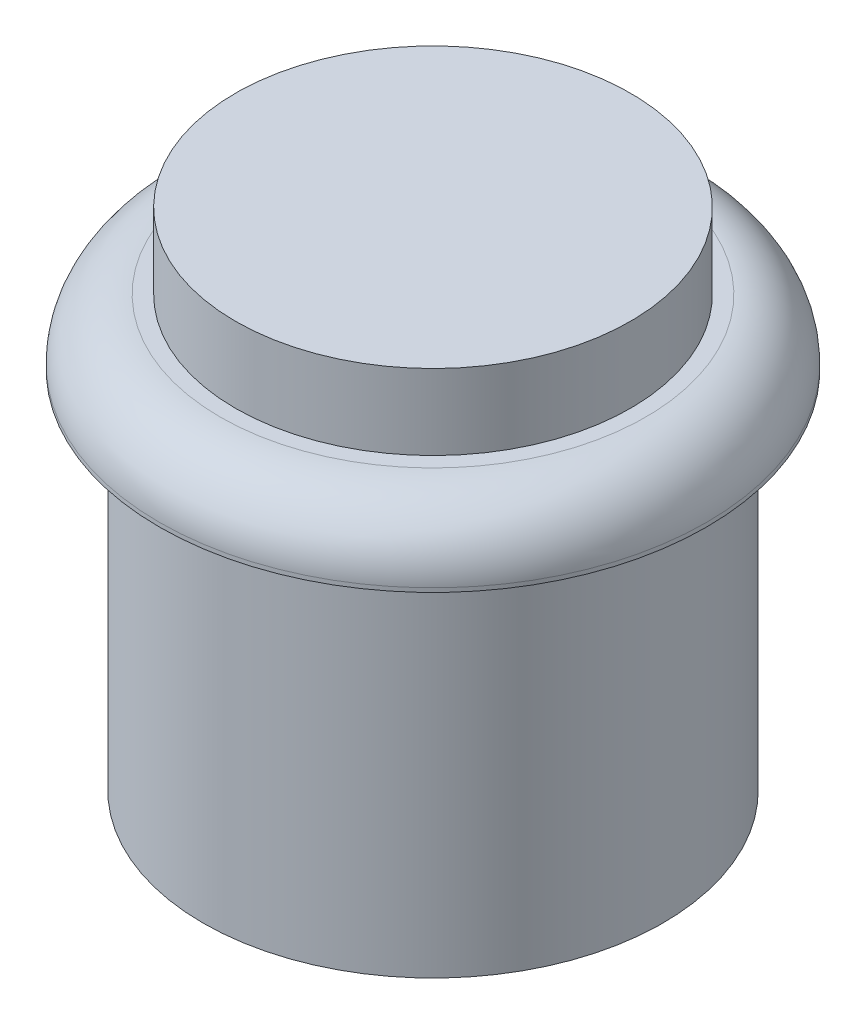
from build123d import *

# Parameters (mm, degrees)
SKETCH1_R           = 11.35
BOSS_EXTRUDE1_DEPTH = 18
SKETCH2_R           = 13.5
BOSS_EXTRUDE2_DEPTH = 3.2
FILLET1_R           = 3
SKETCH3_R           = 9.75
BOSS_EXTRUDE3_DEPTH = 3.72


with BuildPart() as part:
    # Sketch1 → Boss-Extrude1 (new body)
    with BuildSketch(Plane(origin=(0, 0, 0), x_dir=(1, 0, 0), z_dir=(0, 1, 0))):
        with Locations(Location((0, 0, 0), (0, 0, 270))):
            Circle(SKETCH1_R)
    extrude(amount=-BOSS_EXTRUDE1_DEPTH)

    # Sketch2 → Boss-Extrude2 (add)
    with BuildSketch(Plane(origin=(0, 0, 0), x_dir=(1, 0, 0), z_dir=(0, 1, 0))):
        with Locations(Location((0, 0, 0), (0, 0, 270))):
            Circle(SKETCH2_R)
    extrude(amount=BOSS_EXTRUDE2_DEPTH)

    # Fillet1
    fillet1_edges = [part.edges().sort_by_distance(p)[0] for p in [
        (0, 3.2, -13.5),
    ]]
    fillet(fillet1_edges, radius=FILLET1_R)

    # Sketch3 → Boss-Extrude3 (add)
    with BuildSketch(Plane(origin=(0, 3.2, 0), x_dir=(1, 0, 0), z_dir=(0, 1, 0))):
        with Locations(Location((0, 0, 0), (0, 0, 270))):
            Circle(SKETCH3_R)
    extrude(amount=BOSS_EXTRUDE3_DEPTH)


solid = part.part
